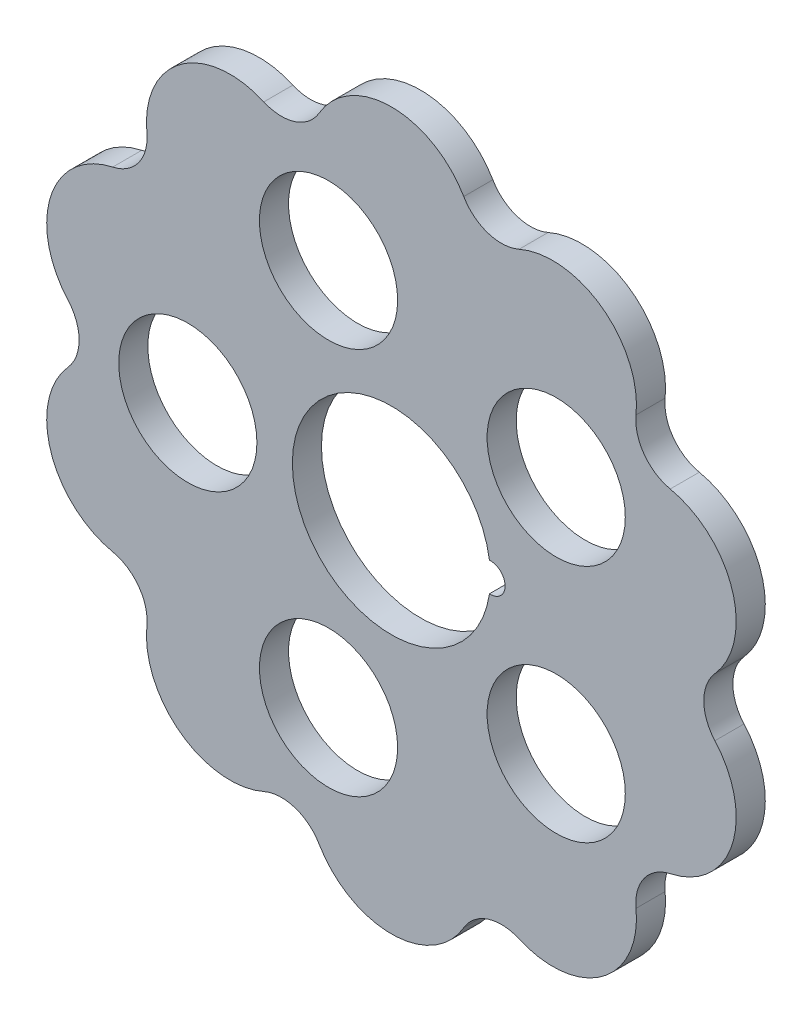
from build123d import *

# Parameters (mm, degrees)
SKETCH_1_R          = 13.625
SKETCH_1_R_2        = 9.5
EXTRUDE_1_DEPTH     = 4
SKETCH_2_R          = 2
CUT_EXTRUDE_1_DEPTH = 4


with BuildPart() as part:
    # 草图1 → 凸台-拉伸1 (new body)
    with BuildSketch(Plane.XY):
        with BuildLine():
            ThreePointArc((-9.939636128, -36.721524578), (0, -42.437612957), (9.939636128, -36.721524578))
            ThreePointArc((9.939636128, -36.721524578), (13.271431273, -34.0328785), (17.547256679, -34.24965882))
            ThreePointArc((17.547256679, -34.24965882), (28.948423675, -33.03169993), (33.629925771, -22.564915761))
            ThreePointArc((33.629925771, -22.564915761), (34.745058151, -18.431375342), (38.331693845, -16.093487189))
            ThreePointArc((38.331693845, -16.093487189), (46.839533428, -8.40669993), (44.474726808, 2.81282423))
            ThreePointArc((44.474726808, 2.81282423), (42.947253757, 6.812387043), (44.474726808, 10.811949856))
            ThreePointArc((44.474726808, 10.811949856), (46.839533428, 22.031474016), (38.331693845, 29.718261275))
            ThreePointArc((38.331693845, 29.718261275), (34.745058151, 32.056149427), (33.629925771, 36.189689846))
            ThreePointArc((33.629925771, 36.189689846), (28.948423675, 46.656474016), (17.547256679, 47.874432905))
            ThreePointArc((17.547256679, 47.874432905), (13.271431273, 47.657652585), (9.939636128, 50.346298663))
            ThreePointArc((9.939636128, 50.346298663), (0, 56.062387043), (-9.939636128, 50.346298663))
            ThreePointArc((-9.939636128, 50.346298663), (-13.271431273, 47.657652585), (-17.547256679, 47.874432905))
            ThreePointArc((-17.547256679, 47.874432905), (-28.948423675, 46.656474016), (-33.629925771, 36.189689846))
            ThreePointArc((-33.629925771, 36.189689846), (-34.745058151, 32.056149427), (-38.331693845, 29.718261275))
            ThreePointArc((-38.331693845, 29.718261275), (-46.839533428, 22.031474016), (-44.474726808, 10.811949856))
            ThreePointArc((-44.474726808, 10.811949856), (-42.947253757, 6.812387043), (-44.474726808, 2.81282423))
            ThreePointArc((-44.474726808, 2.81282423), (-46.839533428, -8.40669993), (-38.331693845, -16.093487189))
            ThreePointArc((-38.331693845, -16.093487189), (-34.745058151, -18.431375342), (-33.629925771, -22.564915761))
            ThreePointArc((-33.629925771, -22.564915761), (-28.948423675, -33.03169993), (-17.547256679, -34.24965882))
            ThreePointArc((-17.547256679, -34.24965882), (-13.271431273, -34.0328785), (-9.939636128, -36.721524578))
        make_face()
        with Locations((0, 6.812387043)):
            Circle(SKETCH_1_R, mode=Mode.SUBTRACT)
        with Locations((-8.652475842, -19.817195414)):
            Circle(SKETCH_1_R_2, mode=Mode.SUBTRACT)
        with Locations((-28, 6.812387043)):
            Circle(SKETCH_1_R_2, mode=Mode.SUBTRACT)
        with Locations((-8.652475842, 33.441969499)):
            Circle(SKETCH_1_R_2, mode=Mode.SUBTRACT)
        with Locations((22.652475842, 23.270374107)):
            Circle(SKETCH_1_R_2, mode=Mode.SUBTRACT)
        with Locations((22.652475842, -9.645600022)):
            Circle(SKETCH_1_R_2, mode=Mode.SUBTRACT)
    extrude(amount=EXTRUDE_1_DEPTH)

    # 草图2 → 切除-拉伸1 (cut)
    with BuildSketch(Plane.XY.offset(4)):
        with Locations((13.625, 6.812387043)):
            Circle(SKETCH_2_R)
    extrude(amount=-CUT_EXTRUDE_1_DEPTH, mode=Mode.SUBTRACT)


solid = part.part
